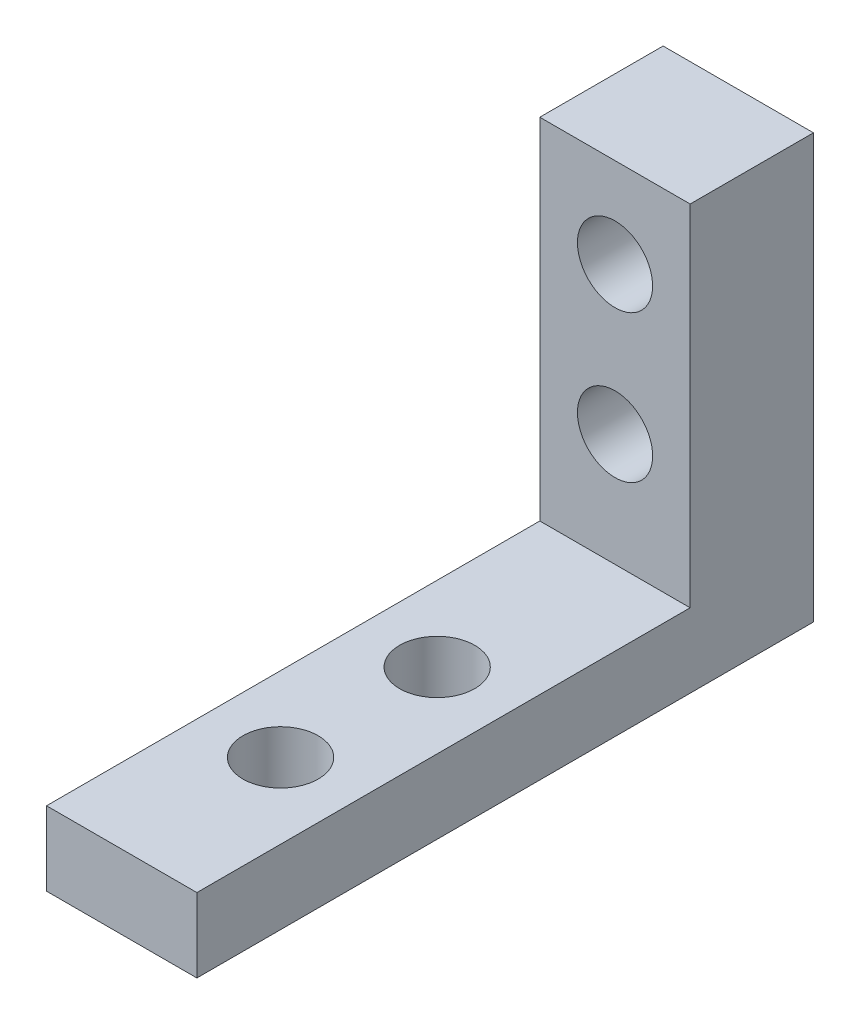
from build123d import *

# Parameters (mm, degrees)
BOSS_EXTRUDE2_DEPTH = 6.096
SKETCH3_R           = 1.524
SKETCH3_R_2         = 1.525
CUT_EXTRUDE1_DEPTH  = 30.380027597
SKETCH4_R           = 1.524
SKETCH4_R_2         = 1.525
CUT_EXTRUDE3_DEPTH  = 26.262343945


with BuildPart() as part:
    # Sketch2 → Boss-Extrude2 (new body)
    with BuildSketch(Plane(origin=(0, 0, 0), x_dir=(0, 0, -1), z_dir=(1, 0, 0))):
        Polygon((0, 0), (0, 14.178321678), (5, 14.178321678), (5, -3), (-20, -3), (-20, 0), align=None)
    extrude(amount=BOSS_EXTRUDE2_DEPTH)

    # Sketch3 → Cut-Extrude1 (cut, through all)
    with BuildSketch(Plane(origin=(0, 0, -5), x_dir=(-1, 0, 0), z_dir=(0, 0, -1))):
        with Locations(Location((-3.05, 10.538720291, 0), (0, 0, 90))):
            Circle(SKETCH3_R)
        with Locations(Location((-3.05, 4.572872866, 0), (0, 0, 90))):
            Circle(SKETCH3_R_2)
    extrude(amount=-CUT_EXTRUDE1_DEPTH, mode=Mode.SUBTRACT)

    # Sketch4 → Cut-Extrude3 (cut, through all)
    with BuildSketch(Plane(origin=(0, 0, 0), x_dir=(1, 0, 0), z_dir=(0, 1, 0))):
        with Locations(Location((3.046, -7.206821765, 0), (0, 0, 270))):
            Circle(SKETCH4_R)
        with Locations(Location((3.046, -13.556821765, 0), (0, 0, 270))):
            Circle(SKETCH4_R_2)
    extrude(amount=-CUT_EXTRUDE3_DEPTH, mode=Mode.SUBTRACT)


solid = part.part
